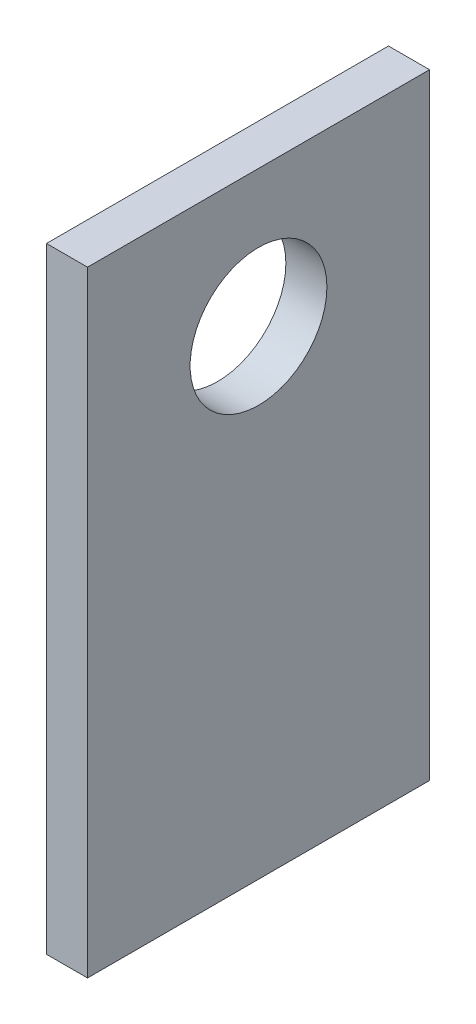
from build123d import *

# Parameters (mm, degrees)
SKETCH1_W           = 25
SKETCH1_H           = 45
BOSS_EXTRUDE1_DEPTH = 3
SKETCH2_R           = 5
CUT_EXTRUDE1_DEPTH  = 3


with BuildPart() as part:
    # Sketch1 → Boss-Extrude1 (new body)
    with BuildSketch(Plane(origin=(0, 0, 0), x_dir=(0, 0, -1), z_dir=(1, 0, 0))):
        Rectangle(SKETCH1_W, SKETCH1_H)
    extrude(amount=BOSS_EXTRUDE1_DEPTH)

    # Sketch2 → Cut-Extrude1 (cut)
    with BuildSketch(Plane(origin=(3, 0, 0), x_dir=(0, 0, -1), z_dir=(1, 0, 0))):
        with Locations((0, 12.5)):
            Circle(SKETCH2_R)
    extrude(amount=-CUT_EXTRUDE1_DEPTH, mode=Mode.SUBTRACT)


solid = part.part
